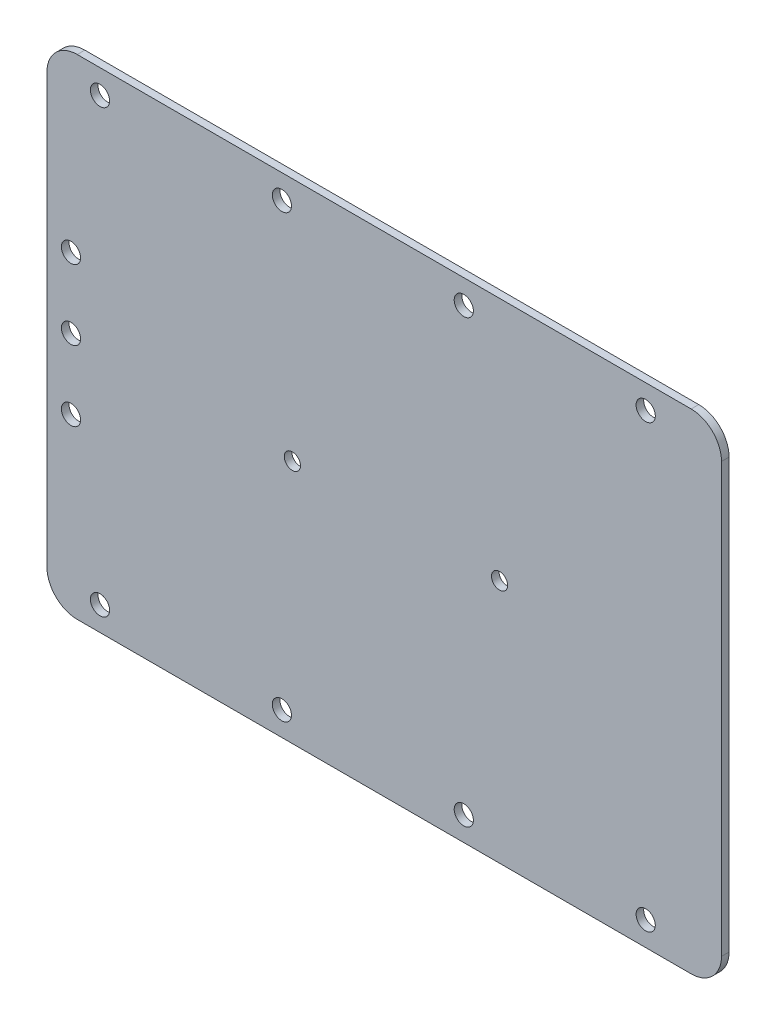
from build123d import *

# Parameters (mm, degrees)
SKETCH1_W             = 133.501685986
SKETCH1_H             = 96.825
BOSS_EXTRUDE1_DEPTH   = 1.5
F_6_CLEARANCE_HOLE1_D = 3.7973
LPATTERN1_COUNT       = 4
LPATTERN1_PITCH       = 36
MIRROR1_COPY_1_D      = 3.7973
MIRROR1_COPY_2_D      = 3.7973
MIRROR1_COPY_3_D      = 3.7973
F_6_CLEARANCE_HOLE2_D = 3.7973
LPATTERN2_COUNT       = 3
LPATTERN2_PITCH       = 13.8875
FILLET1_R             = 6
SKETCH11_R            = 1.6
CUT_EXTRUDE1_DEPTH    = 112.42654106


with BuildPart() as part:
    # Sketch1 → Boss-Extrude1 (new body)
    with BuildSketch(Plane.XY):
        with Locations((2.475842993, -38.8875)):
            Rectangle(SKETCH1_W, SKETCH1_H)
    extrude(amount=BOSS_EXTRUDE1_DEPTH)

    # #6 Clearance Hole1 (through all)
    with Locations(Plane.XY.offset(1.5)):
        with Locations((54.226685986, 4.7625)):
            f_6_clearance_hole1 = Hole(F_6_CLEARANCE_HOLE1_D / 2)

    # LPattern1: #6 Clearance Hole1 ×4
    with Locations(*[(-i * LPATTERN1_PITCH, 0, 0) for i in range(1, LPATTERN1_COUNT)]):
        add(f_6_clearance_hole1, mode=Mode.SUBTRACT)

    # Mirror1: #6 Clearance Hole1 across plane
    add(f_6_clearance_hole1.mirror(Plane.ZX.offset(-38.8875)), mode=Mode.SUBTRACT)

    # Mirror1 copy 1 (through all)
    with Locations(Plane(origin=(-36, -77.775, 1.5), x_dir=(1, 0, 0), z_dir=(0, 0, 1))):
        with Locations((54.226685986, -4.7625)):
            Hole(MIRROR1_COPY_1_D / 2)

    # Mirror1 copy 2 (through all)
    with Locations(Plane(origin=(-72, -77.775, 1.5), x_dir=(1, 0, 0), z_dir=(0, 0, 1))):
        with Locations((54.226685986, -4.7625)):
            Hole(MIRROR1_COPY_2_D / 2)

    # Mirror1 copy 3 (through all)
    with Locations(Plane(origin=(-108, -77.775, 1.5), x_dir=(1, 0, 0), z_dir=(0, 0, 1))):
        with Locations((54.226685986, -4.7625)):
            Hole(MIRROR1_COPY_3_D / 2)

    # #6 Clearance Hole2 (through all)
    with Locations(Plane.XY.offset(1.5)):
        with Locations((-59.5125, -52.775)):
            f_6_clearance_hole2 = Hole(F_6_CLEARANCE_HOLE2_D / 2)

    # LPattern2: #6 Clearance Hole2 ×3
    with Locations(*[(0, i * LPATTERN2_PITCH, 0) for i in range(1, LPATTERN2_COUNT)]):
        add(f_6_clearance_hole2, mode=Mode.SUBTRACT)

    # Fillet1
    fillet1_edges = [part.edges().sort_by_distance(p)[0] for p in [
        (-64.275, -87.3, 0.75),
        (-64.275, 9.525, 0.75),
        (69.226685986, 9.525, 0.75),
        (69.226685986, -87.3, 0.75),
    ]]
    fillet(fillet1_edges, radius=FILLET1_R)

    # Sketch11 → Cut-Extrude1 (cut, through all)
    with BuildSketch(Plane(origin=(0, 0, 0), x_dir=(-1, 0, 0), z_dir=(0, 0, -1))):
        with Locations((-25.301031068, -38.88751017)):
            Circle(SKETCH11_R)
        with Locations((15.699384735, -38.887383169)):
            Circle(SKETCH11_R)
    extrude(amount=-CUT_EXTRUDE1_DEPTH, mode=Mode.SUBTRACT)


solid = part.part
